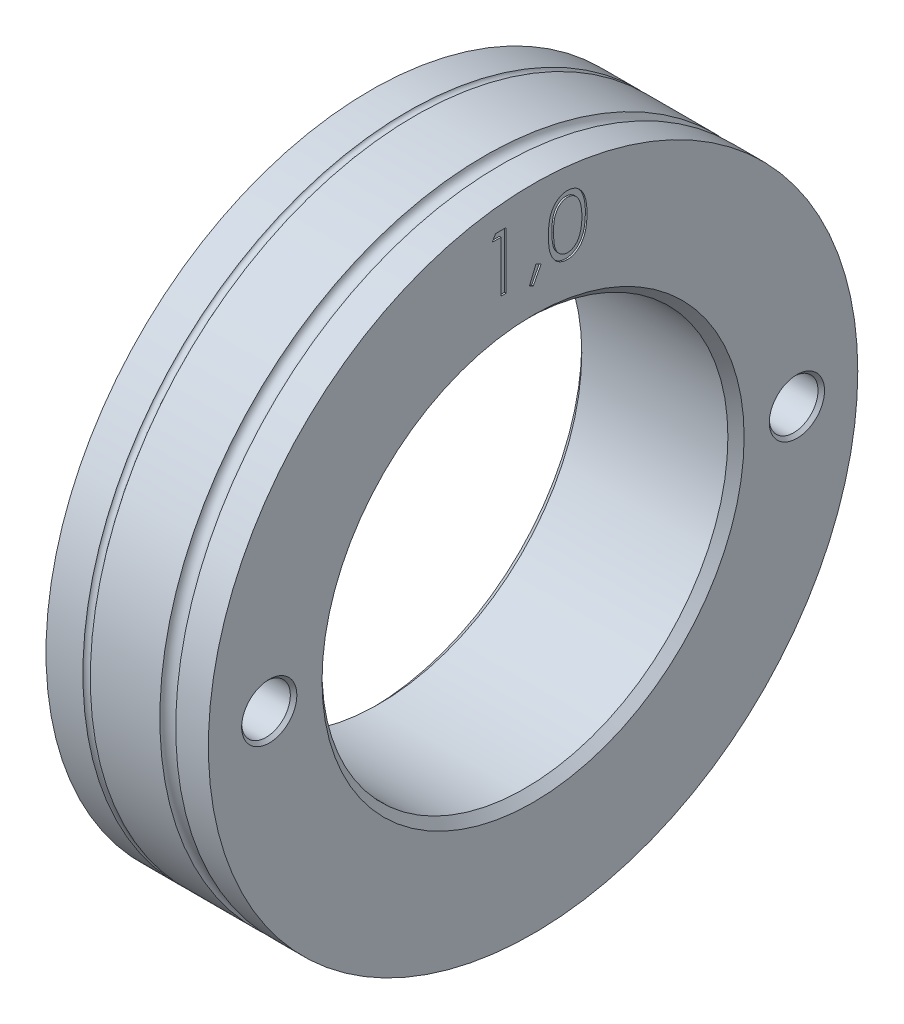
from build123d import *

# Parameters (mm, degrees)
CUT_EXTRUDE_1_DEPTH = 0.1
CUT_EXTRUDE_2_DEPTH = 0.1
SKETCH_5_R          = 1.5
CUT_EXTRUDE_3_DEPTH = 31.000000167
CHAMFER_1_SIZE      = 0.5
CHAMFER_2_SIZE      = 0.2


with BuildPart() as part:
    # Эскиз1 → Повернуть1 (revolve)
    with BuildSketch(Plane.XY):
        with BuildLine():
            Line((-10, 12.5), (0, 12.5))
            Line((0, 12.5), (0, 20))
            Line((0, 20), (-2.010962497, 20))
            ThreePointArc((-2.010962497, 20), (-2.5, 19.604126465), (-2.989037503, 20))
            Line((-2.989037503, 20), (-7.272716742, 20))
            ThreePointArc((-7.272716742, 20), (-7.5, 19.854126465), (-7.727283258, 20))
            Line((-7.727283258, 20), (-10, 20))
            Line((-10, 20), (-10, 12.5))
        make_face()
    revolve(axis=Axis((0, 0, 0), (-1, 0, 0)))

    # Эскиз2 → Вырез-Вытянуть1 (cut)
    # profile 1 of 3: a face of its own
    with BuildSketch(Plane.ZY.offset(10)):
        with BuildLine():
            add(Edge.make_bspline(
                [(-3.365384615, 16.748597756), (-3.365056597, 16.804695144), (-3.364419417, 16.913665128), (-3.357330996, 17.07244977), (-3.345555654, 17.221410059), (-3.329418281, 17.360553125), (-3.309780301, 17.48991489), (-3.283564814, 17.609149647), (-3.253752012, 17.718809254), (-3.219199566, 17.819251302), (-3.180211777, 17.911829005), (-3.137777516, 17.998254207), (-3.090212722, 18.078396139), (-3.040235809, 18.153533929), (-2.985823737, 18.222437624), (-2.928524947, 18.286080287), (-2.86610307, 18.342991037), (-2.800680062, 18.394837339), (-2.731663598, 18.440286811), (-2.661020932, 18.48031955), (-2.588265826, 18.514519417), (-2.513199643, 18.541409853), (-2.436497085, 18.5636207), (-2.357890018, 18.578809647), (-2.277248654, 18.588366556), (-2.22281722, 18.589280224), (-2.19521234, 18.58974359)],
                knots=[0, 0, 0, 0, 1.646270934, 3.197905019, 4.663502075, 6.030701355, 7.308322542, 8.50163776, 9.611534131, 10.641858119, 11.616356847, 12.558055219, 13.465016945, 14.349605745, 15.204443733, 16.039544428, 16.859896111, 17.680448484, 18.487036065, 19.28249412, 20.06191084, 20.843045899, 21.620316918, 22.403196591, 23.190181807, 24, 24, 24, 24], degree=3))
            add(Edge.make_bspline(
                [(-2.19521234, 18.58974359), (-2.167376861, 18.589255775), (-2.112020852, 18.588285664), (-2.030180477, 18.578961721), (-1.950230795, 18.563490598), (-1.872512657, 18.541569623), (-1.79638767, 18.514373947), (-1.722451263, 18.48028683), (-1.650244181, 18.440607962), (-1.580913893, 18.393984085), (-1.513699278, 18.342001809), (-1.450251315, 18.28323914), (-1.390564229, 18.218289421), (-1.333888924, 18.147847557), (-1.281833327, 18.070562472), (-1.232259894, 17.987778362), (-1.187887858, 17.898047497), (-1.145153183, 17.80286703), (-1.108266197, 17.699603371), (-1.074999951, 17.58883861), (-1.048120983, 17.469264423), (-1.02573171, 17.341508178), (-1.008386814, 17.205100695), (-0.995754172, 17.060334379), (-0.989081087, 16.907113989), (-0.987824386, 16.80235614), (-0.987179487, 16.748597756)],
                knots=[0, 0, 0, 0, 0.810914788, 1.612654377, 2.396697861, 3.181598691, 3.963628158, 4.749916497, 5.551656086, 6.361998678, 7.18212741, 8.025565596, 8.878627764, 9.750805457, 10.657531673, 11.591944965, 12.560506719, 13.57287815, 14.630710178, 15.753379473, 16.941251878, 18.199788006, 19.531962791, 20.947069417, 22.433333509, 24, 24, 24, 24], degree=3))
            add(Edge.make_bspline(
                [(-0.987179487, 16.748597756), (-0.987831072, 16.695073848), (-0.989100658, 16.590784697), (-0.995679364, 16.438253721), (-1.008637996, 16.294255678), (-1.024847984, 16.158445216), (-1.047298947, 16.031387597), (-1.074904113, 15.912643148), (-1.105554436, 15.801699077), (-1.14338923, 15.699464265), (-1.18479994, 15.604512542), (-1.229855137, 15.515845394), (-1.278124963, 15.432679101), (-1.330713708, 15.355679354), (-1.386767121, 15.284300697), (-1.44748491, 15.219803074), (-1.511155495, 15.160632402), (-1.578567911, 15.107980775), (-1.648979462, 15.06189597), (-1.720938539, 15.02068212), (-1.795721922, 14.987449425), (-1.871634875, 14.958914384), (-1.949763241, 14.937113932), (-2.030009632, 14.922040077), (-2.111965868, 14.911468228), (-2.167367433, 14.910661748), (-2.19521234, 14.91025641)],
                knots=[0, 0, 0, 0, 1.561518951, 3.042555995, 4.452378317, 5.7783523, 7.031515105, 8.214008947, 9.334062868, 10.386615937, 11.391082383, 12.354592575, 13.286541444, 14.194233754, 15.072674879, 15.931287219, 16.775624067, 17.606195743, 18.42308326, 19.229000347, 20.022332153, 20.807536673, 21.593273796, 22.3848459, 23.188221202, 24, 24, 24, 24], degree=3))
            add(Edge.make_bspline(
                [(-2.19521234, 14.91025641), (-2.222816454, 14.910722766), (-2.277246378, 14.911642328), (-2.357898804, 14.921156059), (-2.436181247, 14.936451562), (-2.512480001, 14.957868166), (-2.587186516, 14.984083003), (-2.659282803, 15.018236686), (-2.729570487, 15.057570755), (-2.797862043, 15.102366177), (-2.862874204, 15.15368786), (-2.924972809, 15.210452149), (-2.982597828, 15.27407556), (-3.036231924, 15.343553483), (-3.087206012, 15.418246725), (-3.134095385, 15.499175098), (-3.17746624, 15.586017709), (-3.21710973, 15.67933562), (-3.252258394, 15.780490547), (-3.283306102, 15.890639726), (-3.307820259, 16.010755362), (-3.328803215, 16.139872729), (-3.345727598, 16.278546659), (-3.357281923, 16.426852438), (-3.364423238, 16.584697647), (-3.365058308, 16.692967421), (-3.365384615, 16.748597756)],
                knots=[0, 0, 0, 0, 0.810891512, 1.598919785, 2.382837074, 3.152667961, 3.926044502, 4.706494248, 5.493654104, 6.291793342, 7.103789334, 7.925228297, 8.761435821, 9.622817696, 10.50288917, 11.416980706, 12.369136599, 13.353924996, 14.394355917, 15.514179734, 16.714354668, 17.994756427, 19.357759367, 20.818452758, 22.365282078, 24, 24, 24, 24], degree=3))
        make_face()
        with BuildLine():
            add(Edge.make_bspline(
                [(-3.051282051, 16.75), (-3.051162604, 16.703251301), (-3.050930781, 16.612521256), (-3.04487458, 16.480677995), (-3.036624348, 16.357707667), (-3.025983051, 16.24345413), (-3.010180103, 16.138304118), (-2.992473315, 16.041534435), (-2.970925225, 15.953657197), (-2.945430207, 15.874069387), (-2.91639111, 15.801420318), (-2.884685247, 15.733819103), (-2.850624524, 15.670467167), (-2.812505373, 15.611933558), (-2.77099031, 15.558027394), (-2.727017051, 15.507794562), (-2.678944467, 15.462997581), (-2.612440724, 15.409270726), (-2.52464425, 15.353751592), (-2.414023794, 15.305405502), (-2.300355344, 15.275023046), (-2.223204093, 15.27115929), (-2.184695513, 15.269230769)],
                knots=[0, 0, 0, 0, 1.459021318, 2.831673884, 4.118529203, 5.306027144, 6.411944654, 7.436330062, 8.375795394, 9.233974572, 10.042671642, 10.816086306, 11.563610507, 12.285937304, 12.993564865, 13.685989202, 14.367179055, 15.041617293, 16.353048772, 17.594441528, 18.799311195, 20, 20, 20, 20], degree=3))
            add(Edge.make_bspline(
                [(-2.184695513, 15.269230769), (-2.145937841, 15.27082855), (-2.068502518, 15.274020813), (-1.955368723, 15.30481955), (-1.845538453, 15.35128909), (-1.759466512, 15.406236595), (-1.693983969, 15.458564925), (-1.647066979, 15.503179573), (-1.60400493, 15.55313544), (-1.563162856, 15.607034736), (-1.52570378, 15.66590722), (-1.491640642, 15.729469796), (-1.460557295, 15.797898973), (-1.442848249, 15.845668713), (-1.433794071, 15.870092147)],
                knots=[0, 0, 0, 0, 1.353760809, 2.704726607, 4.075137775, 5.516104923, 6.260822281, 7.007110065, 7.778089737, 8.566572457, 9.372053459, 10.217411131, 11.088608312, 12, 12, 12, 12], degree=3))
            add(Edge.make_bspline(
                [(-1.433794071, 15.870092147), (-1.423242303, 15.901321887), (-1.401817689, 15.964731651), (-1.374205915, 16.063095303), (-1.352460515, 16.166298067), (-1.33289715, 16.273723184), (-1.319544094, 16.386162885), (-1.30879628, 16.503269269), (-1.302465594, 16.625130631), (-1.301680842, 16.707925622), (-1.301282051, 16.75)],
                knots=[0, 0, 0, 0, 0.884706709, 1.796334032, 2.740027952, 3.714592787, 4.726048262, 5.777819803, 6.87074269, 8, 8, 8, 8], degree=3))
            add(Edge.make_bspline(
                [(-1.301282051, 16.75), (-1.301832241, 16.792067573), (-1.302908528, 16.874360737), (-1.307022516, 16.994878918), (-1.31764609, 17.109346679), (-1.329445209, 17.218257152), (-1.34684243, 17.321007454), (-1.365600237, 17.418457759), (-1.39080145, 17.509400784), (-1.417721225, 17.595260366), (-1.44853162, 17.675061021), (-1.482447354, 17.749174807), (-1.518669113, 17.817959532), (-1.558011354, 17.881226473), (-1.600007037, 17.939259016), (-1.645764586, 17.990893611), (-1.693468959, 18.037730579), (-1.760286144, 18.091193148), (-1.847760434, 18.145704843), (-1.956606082, 18.195870603), (-2.069876726, 18.224678896), (-2.14645018, 18.228740583), (-2.184695513, 18.230769231)],
                knots=[0, 0, 0, 0, 1.31362396, 2.569729283, 3.763502607, 4.902122613, 5.988968491, 7.01645872, 7.998833611, 8.933434873, 9.825090667, 10.667526885, 11.477055099, 12.250526234, 12.991942729, 13.710640831, 14.402115721, 15.076753259, 16.378508321, 17.609869233, 18.806226677, 20, 20, 20, 20], degree=3))
            add(Edge.make_bspline(
                [(-2.184695513, 18.230769231), (-2.223406105, 18.228737784), (-2.300897811, 18.22467119), (-2.415345765, 18.195977936), (-2.525050117, 18.14596497), (-2.612293092, 18.091012598), (-2.679156878, 18.038674287), (-2.726239571, 17.993287833), (-2.770385744, 17.943641578), (-2.811053444, 17.889239663), (-2.849142727, 17.830774296), (-2.88412374, 17.767785531), (-2.915641069, 17.699954167), (-2.944725605, 17.627337732), (-2.970298393, 17.547756787), (-2.991392357, 17.459987794), (-3.01087941, 17.363525902), (-3.024674679, 17.257806394), (-3.036938434, 17.14352424), (-3.044819782, 17.020246922), (-3.05095104, 16.888182542), (-3.051169504, 16.796983383), (-3.051282051, 16.75)],
                knots=[0, 0, 0, 0, 1.207732386, 2.417664972, 3.655092373, 4.956220595, 5.625982001, 6.301752483, 6.994047911, 7.697131622, 8.419323945, 9.170223765, 9.943494443, 10.752040957, 11.610060368, 12.549350801, 13.567764191, 14.679664412, 15.874934091, 17.154273443, 18.533957287, 20, 20, 20, 20], degree=3))
        make_face(mode=Mode.SUBTRACT)
    # profile 2 of 3: a face of its own
    with BuildSketch(Plane.ZY.offset(10)):
        with BuildLine():
            add(Edge.make_bspline(
                [(-0.112179487, 15.538461538), (-0.092689275, 15.537303372), (-0.054480993, 15.535032921), (0.000758136, 15.519456248), (0.050752795, 15.491797587), (0.09528504, 15.454934809), (0.131991517, 15.410239146), (0.160635869, 15.360643237), (0.176076854, 15.304941644), (0.178330766, 15.266511969), (0.179487179, 15.246794872)],
                knots=[0, 0, 0, 0, 1.020151414, 1.999887582, 2.974338812, 3.990962822, 5.007586832, 5.987933904, 6.967670073, 8, 8, 8, 8], degree=3))
            add(Edge.make_bspline(
                [(0.179487179, 15.246794872), (0.178291579, 15.227551542), (0.175933872, 15.189603978), (0.160671264, 15.134322516), (0.131773213, 15.084695611), (0.09553822, 15.039393473), (0.050741787, 15.002452603), (0.00063994, 14.975029258), (-0.054351318, 14.958337278), (-0.092667641, 14.956210981), (-0.112179487, 14.955128205)],
                knots=[0, 0, 0, 0, 1.009421747, 1.99056486, 2.972319754, 3.999869655, 5.017953583, 5.993804169, 6.978383603, 8, 8, 8, 8], degree=3))
            add(Edge.make_bspline(
                [(-0.112179487, 14.955128205), (-0.131705393, 14.956171802), (-0.169825075, 14.958209177), (-0.22461107, 14.975371984), (-0.275018038, 15.002195444), (-0.31980575, 15.039462353), (-0.356344222, 15.084462497), (-0.383969604, 15.134664293), (-0.400559753, 15.189445731), (-0.402741626, 15.227520373), (-0.403846154, 15.246794872)],
                knots=[0, 0, 0, 0, 1.022052826, 1.995314843, 2.982371812, 4.00089066, 5.028879526, 6.005146991, 6.990147033, 8, 8, 8, 8], degree=3))
            add(Edge.make_bspline(
                [(-0.403846154, 15.246794872), (-0.402784055, 15.266544251), (-0.400710436, 15.305102491), (-0.383934776, 15.360301599), (-0.356558564, 15.410470038), (-0.319553169, 15.454866618), (-0.275028873, 15.492053921), (-0.224732668, 15.519118714), (-0.169693128, 15.535159126), (-0.131683189, 15.537341643), (-0.112179487, 15.538461538)],
                knots=[0, 0, 0, 0, 1.032775665, 2.016367738, 2.991239715, 4.008302682, 5.025365648, 6.011011707, 6.979408107, 8, 8, 8, 8], degree=3))
        make_face()
    # profile 3 of 3: a face of its own
    with BuildSketch(Plane.ZY.offset(10)):
        with BuildLine():
            Line((2.826923077, 18.5), (2.826923077, 18.141025641))
            Line((2.826923077, 18.141025641), (1.636418269, 18.141025641))
            Line((1.636418269, 18.141025641), (1.447816506, 17.220452724))
            add(Edge.make_bspline(
                [(1.447816506, 17.220452724), (1.484872381, 17.230682996), (1.556662277, 17.25050253), (1.662622138, 17.2725083), (1.763214341, 17.285773744), (1.828489711, 17.287585055), (1.860076122, 17.288461538)],
                knots=[0, 0, 0, 0, 1.100273476, 2.13160584, 3.095893838, 4, 4, 4, 4], degree=3))
            add(Edge.make_bspline(
                [(1.860076122, 17.288461538), (1.899159862, 17.287615603), (1.976008259, 17.285952282), (2.088447206, 17.269980432), (2.195780099, 17.244840518), (2.297782469, 17.209719996), (2.39464302, 17.164810263), (2.485470581, 17.108710322), (2.571628494, 17.043176991), (2.651571088, 16.967831979), (2.724095396, 16.884910363), (2.787861386, 16.795752492), (2.842023976, 16.701224829), (2.885584731, 16.600424221), (2.920369066, 16.494465067), (2.94352106, 16.382232485), (2.958937769, 16.264784365), (2.960660156, 16.184479795), (2.961538462, 16.143529647)],
                knots=[0, 0, 0, 0, 1.052922333, 2.070308379, 3.05430497, 4.020497103, 4.973039431, 5.925935799, 6.892292201, 7.88610001, 8.88166317, 9.857072816, 10.836096531, 11.812156883, 12.81219415, 13.836441305, 14.89672472, 16, 16, 16, 16], degree=3))
            add(Edge.make_bspline(
                [(2.961538462, 16.143529647), (2.960873386, 16.115007427), (2.959552224, 16.05834844), (2.952833636, 15.974204239), (2.93989792, 15.891841406), (2.922530196, 15.811249014), (2.899987778, 15.732579642), (2.872698724, 15.655608114), (2.839302696, 15.580813507), (2.802671321, 15.507488112), (2.761424843, 15.437289605), (2.715646336, 15.371640618), (2.667280845, 15.309556337), (2.615239459, 15.251702604), (2.559038464, 15.198459586), (2.499358497, 15.149511304), (2.436675778, 15.104029974), (2.370020536, 15.063861779), (2.300878053, 15.026898823), (2.228249836, 14.996575285), (2.153789135, 14.969464757), (2.07642426, 14.94785523), (1.996330447, 14.930922675), (1.913375672, 14.919422075), (1.827995002, 14.911045637), (1.770119989, 14.91052128), (1.740885417, 14.91025641)],
                knots=[0, 0, 0, 0, 1.056347294, 2.098418968, 3.122841568, 4.141288669, 5.149314143, 6.15115421, 7.162517403, 8.180376062, 9.185164535, 10.17417709, 11.141909838, 12.097768115, 13.052685741, 14.0056014, 14.954263652, 15.917497458, 16.885230207, 17.854509472, 18.828990115, 19.81800267, 20.826176721, 21.857883937, 22.917946725, 24, 24, 24, 24], degree=3))
            add(Edge.make_bspline(
                [(1.740885417, 14.91025641), (1.706011236, 14.910947248), (1.637400405, 14.91230639), (1.536879838, 14.926524876), (1.440165232, 14.946888792), (1.348035131, 14.977525062), (1.259663868, 15.015912357), (1.17624115, 15.064428528), (1.095635374, 15.119407632), (1.021123337, 15.184287985), (0.951967224, 15.255203667), (0.890060715, 15.332161308), (0.834927138, 15.41389075), (0.787449391, 15.500788904), (0.74695137, 15.592627435), (0.715136381, 15.689750436), (0.689458026, 15.79165044), (0.678594606, 15.86180395), (0.673076923, 15.897435897)],
                knots=[0, 0, 0, 0, 1.0467383, 2.05933395, 3.04377827, 4.011590433, 4.970194871, 5.932262533, 6.905835911, 7.896367577, 8.894135286, 9.877477877, 10.858688626, 11.851381753, 12.8477658, 13.868841284, 14.917554742, 16, 16, 16, 16], degree=3))
            Line((0.673076923, 15.897435897), (0.987179487, 15.897435897))
            add(Edge.make_bspline(
                [(0.987179487, 15.897435897), (0.994908045, 15.864059445), (1.009762761, 15.79990805), (1.04236851, 15.709776709), (1.082234385, 15.629457485), (1.129638734, 15.557887902), (1.186188764, 15.495478905), (1.250718193, 15.439861843), (1.323065916, 15.389686713), (1.403459146, 15.347863946), (1.488272225, 15.312195193), (1.577039435, 15.288443498), (1.667343782, 15.271742605), (1.728422152, 15.270070844), (1.759114583, 15.269230769)],
                knots=[0, 0, 0, 0, 1.136247022, 2.183929868, 3.172523383, 4.106158343, 5.02341133, 5.958108904, 6.928429099, 7.938127109, 8.96079061, 9.975095812, 10.982467395, 12, 12, 12, 12], degree=3))
            add(Edge.make_bspline(
                [(1.759114583, 15.269230769), (1.789073028, 15.270051547), (1.84806145, 15.271667666), (1.934872837, 15.284106678), (2.018685711, 15.303264249), (2.098673068, 15.331934104), (2.176234607, 15.366778822), (2.249408378, 15.411493898), (2.320311255, 15.462953917), (2.386739388, 15.521910547), (2.447578838, 15.586880241), (2.501334959, 15.656357635), (2.546111872, 15.730474481), (2.583845981, 15.807947634), (2.61249928, 15.889626191), (2.632940261, 15.975127366), (2.64494332, 16.064662347), (2.6465945, 16.125731656), (2.647435897, 16.156850962)],
                knots=[0, 0, 0, 0, 1.027316725, 2.022795036, 3.002884548, 3.971462791, 4.93288096, 5.914575861, 6.907176829, 7.935150275, 8.956128384, 9.956726525, 10.942570165, 11.921478529, 12.907843606, 13.90538589, 14.932640048, 16, 16, 16, 16], degree=3))
            add(Edge.make_bspline(
                [(2.647435897, 16.156850962), (2.646777418, 16.184926713), (2.645488538, 16.239881002), (2.634957968, 16.320280209), (2.616640995, 16.396353251), (2.591217116, 16.468467485), (2.558937608, 16.536690927), (2.519491295, 16.601093987), (2.472137898, 16.660827821), (2.418046009, 16.715920374), (2.358787968, 16.766765249), (2.293344225, 16.810109336), (2.223084299, 16.846573253), (2.148854699, 16.878041252), (2.068889801, 16.900641997), (1.984773168, 16.917609882), (1.89559646, 16.927425245), (1.834625772, 16.928787134), (1.803285256, 16.929487179)],
                knots=[0, 0, 0, 0, 1.045622112, 2.046656509, 3.013763289, 3.955457236, 4.890082067, 5.820317437, 6.762574623, 7.722996705, 8.69280354, 9.665887285, 10.63943826, 11.638615906, 12.663482002, 13.728887084, 14.832589034, 16, 16, 16, 16], degree=3))
            add(Edge.make_bspline(
                [(1.803285256, 16.929487179), (1.776156328, 16.928906588), (1.720141972, 16.927707815), (1.634219146, 16.918881318), (1.543927423, 16.904642024), (1.449612927, 16.885055776), (1.350992419, 16.859424699), (1.248274018, 16.828710199), (1.141241752, 16.7919882), (1.069124027, 16.764255986), (1.032051282, 16.75)],
                knots=[0, 0, 0, 0, 0.817624296, 1.688186739, 2.600797293, 3.572016777, 4.590301741, 5.671205678, 6.80286297, 8, 8, 8, 8], degree=3))
            Line((1.032051282, 16.75), (1.391025641, 18.5))
            Line((1.391025641, 18.5), (2.826923077, 18.5))
        make_face()
    extrude(amount=-CUT_EXTRUDE_1_DEPTH, mode=Mode.SUBTRACT)

    # Эскиз4 → Вырез-Вытянуть2 (cut)
    # profile 1 of 3: a face of its own
    with BuildSketch(Plane(origin=(0, 0, 0), x_dir=(0, 0, -1), z_dir=(1, 0, 0))):
        with BuildLine():
            add(Edge.make_bspline(
                [(0.942307692, 16.748597756), (0.94263571, 16.804695144), (0.94327289, 16.913665128), (0.950361311, 17.07244977), (0.962136654, 17.221410059), (0.978274027, 17.360553125), (0.997912007, 17.48991489), (1.024127493, 17.609149647), (1.053940296, 17.718809254), (1.088492742, 17.819251302), (1.127480531, 17.911829005), (1.169914792, 17.998254207), (1.217479586, 18.078396139), (1.267456499, 18.153533929), (1.321868571, 18.222437624), (1.379167361, 18.286080287), (1.441589237, 18.342991037), (1.507012246, 18.394837339), (1.57602871, 18.440286811), (1.646671376, 18.48031955), (1.719426482, 18.514519417), (1.794492665, 18.541409853), (1.871195223, 18.5636207), (1.949802289, 18.578809647), (2.030443653, 18.588366556), (2.084875088, 18.589280224), (2.112479968, 18.58974359)],
                knots=[0, 0, 0, 0, 1.646270934, 3.197905019, 4.663502075, 6.030701355, 7.308322542, 8.50163776, 9.611534131, 10.641858119, 11.616356847, 12.558055219, 13.465016945, 14.349605745, 15.204443733, 16.039544428, 16.859896111, 17.680448484, 18.487036065, 19.28249412, 20.06191084, 20.843045899, 21.620316918, 22.403196591, 23.190181807, 24, 24, 24, 24], degree=3))
            add(Edge.make_bspline(
                [(2.112479968, 18.58974359), (2.140315446, 18.589255775), (2.195671455, 18.588285664), (2.277511831, 18.578961721), (2.357461512, 18.563490598), (2.435179651, 18.541569623), (2.511304637, 18.514373947), (2.585241045, 18.48028683), (2.657448127, 18.440607962), (2.726778414, 18.393984085), (2.79399303, 18.342001809), (2.857440993, 18.28323914), (2.917128078, 18.218289421), (2.973803384, 18.147847557), (3.025858981, 18.070562472), (3.075432413, 17.987778362), (3.119804449, 17.898047497), (3.162539124, 17.80286703), (3.199426111, 17.699603371), (3.232692356, 17.58883861), (3.259571325, 17.469264423), (3.281960597, 17.341508178), (3.299305493, 17.205100695), (3.311938135, 17.060334379), (3.31861122, 16.907113989), (3.319867922, 16.80235614), (3.320512821, 16.748597756)],
                knots=[0, 0, 0, 0, 0.810914788, 1.612654377, 2.396697861, 3.181598691, 3.963628158, 4.749916497, 5.551656086, 6.361998678, 7.18212741, 8.025565596, 8.878627764, 9.750805457, 10.657531673, 11.591944965, 12.560506719, 13.57287815, 14.630710178, 15.753379473, 16.941251878, 18.199788006, 19.531962791, 20.947069417, 22.433333509, 24, 24, 24, 24], degree=3))
            add(Edge.make_bspline(
                [(3.320512821, 16.748597756), (3.319861236, 16.695073848), (3.31859165, 16.590784697), (3.312012943, 16.438253721), (3.299054312, 16.294255678), (3.282844324, 16.158445216), (3.260393361, 16.031387597), (3.232788195, 15.912643148), (3.202137872, 15.801699077), (3.164303078, 15.699464265), (3.122892367, 15.604512542), (3.077837171, 15.515845394), (3.029567345, 15.432679101), (2.9769786, 15.355679354), (2.920925187, 15.284300697), (2.860207398, 15.219803074), (2.796536813, 15.160632402), (2.729124397, 15.107980775), (2.658712846, 15.06189597), (2.586753769, 15.02068212), (2.511970386, 14.987449425), (2.436057433, 14.958914384), (2.357929067, 14.937113932), (2.277682676, 14.922040077), (2.19572644, 14.911468228), (2.140324875, 14.910661748), (2.112479968, 14.91025641)],
                knots=[0, 0, 0, 0, 1.561518951, 3.042555995, 4.452378317, 5.7783523, 7.031515105, 8.214008947, 9.334062868, 10.386615937, 11.391082383, 12.354592575, 13.286541444, 14.194233754, 15.072674879, 15.931287219, 16.775624067, 17.606195743, 18.42308326, 19.229000347, 20.022332153, 20.807536673, 21.593273796, 22.3848459, 23.188221202, 24, 24, 24, 24], degree=3))
            add(Edge.make_bspline(
                [(2.112479968, 14.91025641), (2.084875854, 14.910722766), (2.030445929, 14.911642328), (1.949793504, 14.921156059), (1.87151106, 14.936451562), (1.795212306, 14.957868166), (1.720505791, 14.984083003), (1.648409505, 15.018236686), (1.578121821, 15.057570755), (1.509830265, 15.102366177), (1.444818104, 15.15368786), (1.382719498, 15.210452149), (1.325094479, 15.27407556), (1.271460384, 15.343553483), (1.220486296, 15.418246725), (1.173596922, 15.499175098), (1.130226068, 15.586017709), (1.090582578, 15.67933562), (1.055433914, 15.780490547), (1.024386206, 15.890639726), (0.999872048, 16.010755362), (0.978889093, 16.139872729), (0.96196471, 16.278546659), (0.950410385, 16.426852438), (0.94326907, 16.584697647), (0.942633999, 16.692967421), (0.942307692, 16.748597756)],
                knots=[0, 0, 0, 0, 0.810891512, 1.598919785, 2.382837074, 3.152667961, 3.926044502, 4.706494248, 5.493654104, 6.291793342, 7.103789334, 7.925228297, 8.761435821, 9.622817696, 10.50288917, 11.416980706, 12.369136599, 13.353924996, 14.394355917, 15.514179734, 16.714354668, 17.994756427, 19.357759367, 20.818452758, 22.365282078, 24, 24, 24, 24], degree=3))
        make_face()
        with BuildLine():
            add(Edge.make_bspline(
                [(1.256410256, 16.75), (1.256529703, 16.703251301), (1.256761527, 16.612521256), (1.262817727, 16.480677995), (1.271067959, 16.357707667), (1.281709257, 16.24345413), (1.297512205, 16.138304118), (1.315218993, 16.041534435), (1.336767083, 15.953657197), (1.3622621, 15.874069387), (1.391301197, 15.801420318), (1.423007061, 15.733819103), (1.457067784, 15.670467167), (1.495186934, 15.611933558), (1.536701998, 15.558027394), (1.580675257, 15.507794562), (1.628747841, 15.462997581), (1.695251584, 15.409270726), (1.783048058, 15.353751592), (1.893668513, 15.305405502), (2.007336964, 15.275023046), (2.084488214, 15.27115929), (2.122996795, 15.269230769)],
                knots=[0, 0, 0, 0, 1.459021318, 2.831673884, 4.118529203, 5.306027144, 6.411944654, 7.436330062, 8.375795394, 9.233974572, 10.042671642, 10.816086306, 11.563610507, 12.285937304, 12.993564865, 13.685989202, 14.367179055, 15.041617293, 16.353048772, 17.594441528, 18.799311195, 20, 20, 20, 20], degree=3))
            add(Edge.make_bspline(
                [(2.122996795, 15.269230769), (2.161754467, 15.27082855), (2.23918979, 15.274020813), (2.352323585, 15.30481955), (2.462153855, 15.35128909), (2.548225795, 15.406236595), (2.613708339, 15.458564925), (2.660625329, 15.503179573), (2.703687377, 15.55313544), (2.744529452, 15.607034736), (2.781988528, 15.66590722), (2.816051665, 15.729469796), (2.847135013, 15.797898973), (2.864844059, 15.845668713), (2.873898237, 15.870092147)],
                knots=[0, 0, 0, 0, 1.353760809, 2.704726607, 4.075137775, 5.516104923, 6.260822281, 7.007110065, 7.778089737, 8.566572457, 9.372053459, 10.217411131, 11.088608312, 12, 12, 12, 12], degree=3))
            add(Edge.make_bspline(
                [(2.873898237, 15.870092147), (2.884450005, 15.901321887), (2.905874619, 15.964731651), (2.933486393, 16.063095303), (2.955231792, 16.166298067), (2.974795158, 16.273723184), (2.988148214, 16.386162885), (2.998896027, 16.503269269), (3.005226714, 16.625130631), (3.006011465, 16.707925622), (3.006410256, 16.75)],
                knots=[0, 0, 0, 0, 0.884706709, 1.796334032, 2.740027952, 3.714592787, 4.726048262, 5.777819803, 6.87074269, 8, 8, 8, 8], degree=3))
            add(Edge.make_bspline(
                [(3.006410256, 16.75), (3.005860067, 16.792067573), (3.004783779, 16.874360737), (3.000669792, 16.994878918), (2.990046217, 17.109346679), (2.978247098, 17.218257152), (2.960849877, 17.321007454), (2.94209207, 17.418457759), (2.916890858, 17.509400784), (2.889971083, 17.595260366), (2.859160688, 17.675061021), (2.825244953, 17.749174807), (2.789023195, 17.817959532), (2.749680954, 17.881226473), (2.707685271, 17.939259016), (2.661927722, 17.990893611), (2.614223349, 18.037730579), (2.547406163, 18.091193148), (2.459931873, 18.145704843), (2.351086226, 18.195870603), (2.237815582, 18.224678896), (2.161242128, 18.228740583), (2.122996795, 18.230769231)],
                knots=[0, 0, 0, 0, 1.31362396, 2.569729283, 3.763502607, 4.902122613, 5.988968491, 7.01645872, 7.998833611, 8.933434873, 9.825090667, 10.667526885, 11.477055099, 12.250526234, 12.991942729, 13.710640831, 14.402115721, 15.076753259, 16.378508321, 17.609869233, 18.806226677, 20, 20, 20, 20], degree=3))
            add(Edge.make_bspline(
                [(2.122996795, 18.230769231), (2.084286203, 18.228737784), (2.006794497, 18.22467119), (1.892346542, 18.195977936), (1.782642191, 18.14596497), (1.695399216, 18.091012598), (1.62853543, 18.038674287), (1.581452736, 17.993287833), (1.537306564, 17.943641578), (1.496638864, 17.889239663), (1.458549581, 17.830774296), (1.423568568, 17.767785531), (1.392051238, 17.699954167), (1.362966702, 17.627337732), (1.337393914, 17.547756787), (1.316299951, 17.459987794), (1.296812898, 17.363525902), (1.283017629, 17.257806394), (1.270753873, 17.14352424), (1.262872525, 17.020246922), (1.256741268, 16.888182542), (1.256522803, 16.796983383), (1.256410256, 16.75)],
                knots=[0, 0, 0, 0, 1.207732386, 2.417664972, 3.655092373, 4.956220595, 5.625982001, 6.301752483, 6.994047911, 7.697131622, 8.419323945, 9.170223765, 9.943494443, 10.752040957, 11.610060368, 12.549350801, 13.567764191, 14.679664412, 15.874934091, 17.154273443, 18.533957287, 20, 20, 20, 20], degree=3))
        make_face(mode=Mode.SUBTRACT)
    # profile 2 of 3: a face of its own
    with BuildSketch(Plane(origin=(0, 0, 0), x_dir=(0, 0, -1), z_dir=(1, 0, 0))):
        Polygon((0.172475962, 15.628205128), (0.493589744, 15.47255609), (0.011217949, 14.551282051), (-0.224358974, 14.653645833), align=None)
    # profile 3 of 3: a face of its own
    with BuildSketch(Plane(origin=(0, 0, 0), x_dir=(0, 0, -1), z_dir=(1, 0, 0))):
        Polygon((-2.307391827, 18.5), (-1.66025641, 18.5), (-1.66025641, 15), (-1.974358974, 15), (-1.974358974, 18.141025641), (-2.512820513, 18.141025641), align=None)
    extrude(amount=-CUT_EXTRUDE_2_DEPTH, mode=Mode.SUBTRACT)

    # Эскиз5 → Вырез-Вытянуть3 (cut, through all)
    with BuildSketch(Plane.ZY.offset(10)):
        with Locations((-16.25, 0)):
            Circle(SKETCH_5_R)
        with Locations((16.25, 0)):
            Circle(SKETCH_5_R)
    extrude(amount=-CUT_EXTRUDE_3_DEPTH, mode=Mode.SUBTRACT)

    # Фаска1
    chamfer_1_edges = [part.edges().sort_by_distance(p)[0] for p in [
        (0, -12.5, 0),
        (-10, -12.5, 0),
    ]]
    chamfer(chamfer_1_edges, length=CHAMFER_1_SIZE)

    # Фаска2
    chamfer_2_edges = [part.edges().sort_by_distance(p)[0] for p in [
        (0, 0, -17.75),
        (0, 0, 14.75),
        (-10, 0, 14.75),
        (-10, 0, -17.75),
    ]]
    chamfer(chamfer_2_edges, length=CHAMFER_2_SIZE)


solid = part.part
